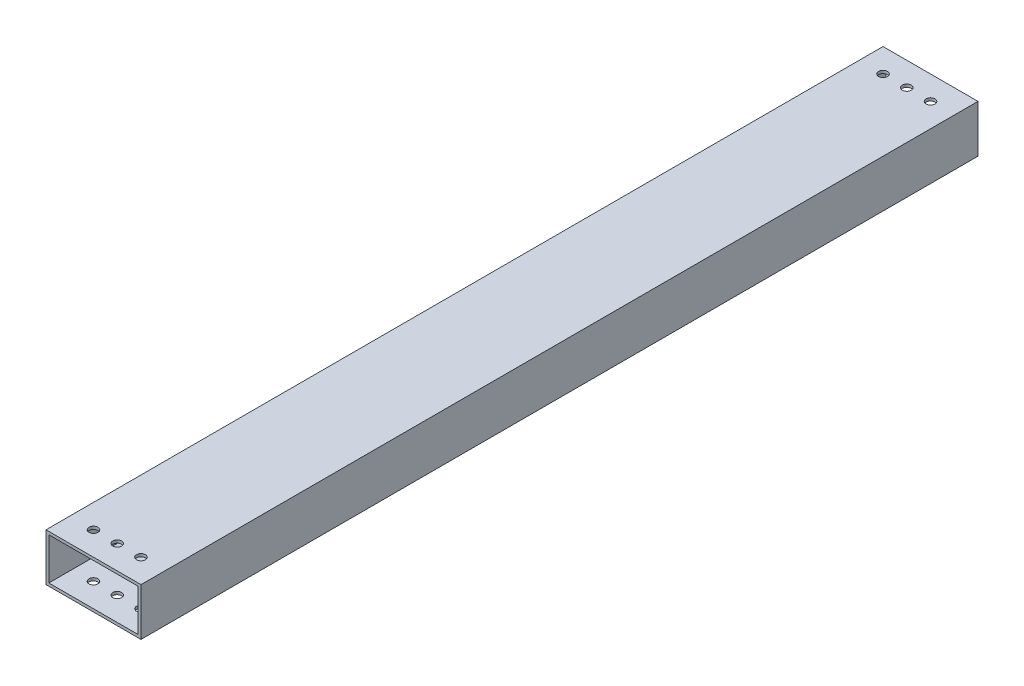
from build123d import *

# Parameters (mm, degrees)
SKETCH1_W               = 50.8
SKETCH1_H               = 25.4
SKETCH1_W_2             = 47.752
SKETCH1_H_2             = 22.352
EXTRUDE_THIN1_DEPTH     = 447.675
CUT_EXTRUDE1_DEPTH      = 452.263454786
CUT_EXTRUDE1_DEPTH_BACK = 452.263454786
SKETCH2_R               = 2.38125


with BuildPart() as part:
    # Sketch1 → Extrude-Thin1 (new body)
    with BuildSketch(Plane.XY):
        with Locations((-25.4, 12.7)):
            Rectangle(SKETCH1_W, SKETCH1_H)
        with Locations((-25.4, 12.7)):
            Rectangle(SKETCH1_W_2, SKETCH1_H_2, mode=Mode.SUBTRACT)
    extrude(amount=EXTRUDE_THIN1_DEPTH)

    # Sketch2 → Cut-Extrude1 (cut, two sides: drawn at the far end of the back side and taken through both)
    with BuildSketch(Plane(origin=(0, 25.4, 0), x_dir=(1, 0, 0), z_dir=(0, 1, 0)).offset(-CUT_EXTRUDE1_DEPTH_BACK)):
        with Locations(Location((-38.1, -434.975, 0), (0, 0, 180))):
            Circle(SKETCH2_R)
        with Locations(Location((-25.4, -434.975, 0), (0, 0, 180))):
            Circle(SKETCH2_R)
        with Locations(Location((-12.7, -434.975, 0), (0, 0, 180))):
            Circle(SKETCH2_R)
        with Locations(Location((-38.1, -12.7, 0), (0, 0, 90))):
            Circle(SKETCH2_R)
        with Locations(Location((-12.7, -12.7, 0), (0, 0, 90))):
            Circle(SKETCH2_R)
        with Locations(Location((-25.4, -12.7, 0), (0, 0, 90))):
            Circle(SKETCH2_R)
    extrude(amount=CUT_EXTRUDE1_DEPTH + CUT_EXTRUDE1_DEPTH_BACK, mode=Mode.SUBTRACT)


solid = part.part
